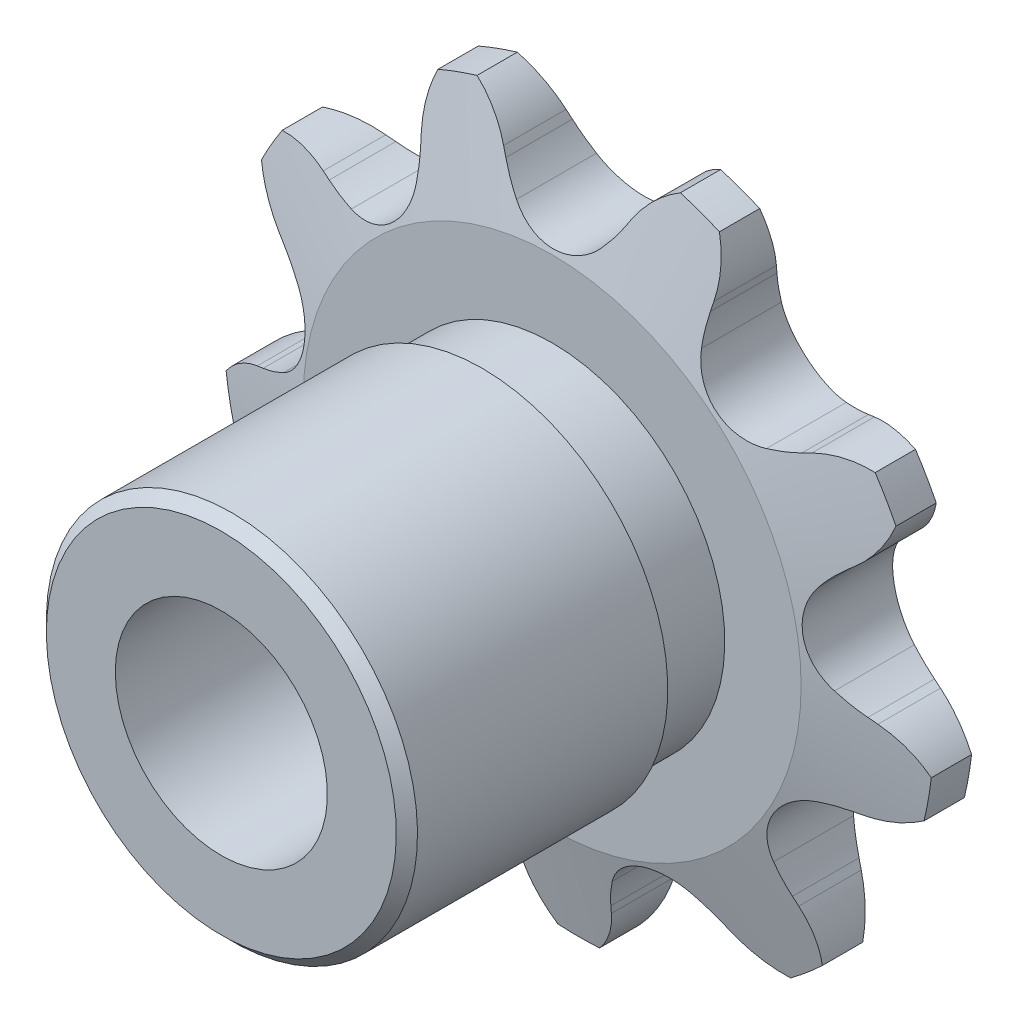
from build123d import *

# Parameters (mm, degrees)
CUT_EXTRUDE1_DEPTH      = 16.095383874
CIRPATTERN1_COUNT       = 9
BOSS_EXTRUDE1_START     = 1.397
SKETCH2_R               = 5.55625
BOSS_EXTRUDE1_DEPTH     = 9.906
CUT_EXTRUDE2_DEPTH      = 19.76608009
CUT_EXTRUDE2_DEPTH_BACK = 19.76608009
SKETCH3_R               = 3.175
SKETCH4_W               = 2.0955
SKETCH4_H               = 5.461


with BuildPart() as part:
    # Sketch1 → Revolve1 (revolve)
    with BuildSketch(Plane(origin=(0, 0, 0), x_dir=(0, 0, -1), z_dir=(1, 0, 0)), mode=Mode.PRIVATE) as revolve1_sk:
        Polygon((1.397, 0), (-1.397, 0), (-1.397, 7.453240807), (-0.60325, 10.628240807), (0.60325, 10.628240807), (1.397, 7.453240807), align=None)
    revolve(revolve1_sk.sketch.rotate(Axis((0, 0, -1.397), (0, 0, 1)), 90), axis=Axis((0, 0, -1.397), (0, 0, 1)))

    # Sketch0 → Cut-Extrude1 (cut, symmetric)
    with BuildSketch(Plane.XY):
        with BuildLine():
            Line((4.911569247, -7.894070248), (4.716762685, -7.729963314))
            ThreePointArc((4.716762685, -7.729963314), (4.36154183, -7.46066159), (3.980565311, -7.229226574))
            ThreePointArc((3.980565311, -7.229226574), (2.5944704, -7.128248838), (1.597567333, -8.096566907))
            ThreePointArc((1.597567333, -8.096566907), (1.454485948, -8.518743401), (1.355474797, -8.953372055))
            Line((1.355474797, -8.953372055), (1.311730217, -9.204304503))
            ThreePointArc((1.311730217, -9.204304503), (0.172611941, -11.008124707), (-1.906433811, -11.486587387))
            ThreePointArc((-1.906433811, -11.486587387), (3.982386258, -10.94151632), (8.843849078, -7.573804406))
            ThreePointArc((8.843849078, -7.573804406), (6.94365775, -8.543665578), (4.911569247, -7.894070248))
        make_face()
    cut_extrude1 = extrude(amount=CUT_EXTRUDE1_DEPTH, both=True, mode=Mode.SUBTRACT)

    # CirPattern1: Cut-Extrude1 ×9 about axis
    cirpattern1_axis = Axis((0, 0, 0), (0, 0, 1))
    for i in range(1, CIRPATTERN1_COUNT):
        add(cut_extrude1.rotate(cirpattern1_axis, i * 360 / CIRPATTERN1_COUNT), mode=Mode.SUBTRACT)

    # Sketch2 → Boss-Extrude1 (add)
    with BuildSketch(Plane.XY.offset(BOSS_EXTRUDE1_START)):
        Circle(SKETCH2_R)
    extrude(amount=BOSS_EXTRUDE1_DEPTH)

    # Sketch3 → Cut-Extrude2 (cut, two sides: drawn at the far end of the back side and taken through both)
    with BuildSketch(Plane.XY.offset(-CUT_EXTRUDE2_DEPTH_BACK)):
        with Locations(Location((0, 0, 0), (0, 0, 180))):
            Circle(SKETCH3_R)
    extrude(amount=CUT_EXTRUDE2_DEPTH + CUT_EXTRUDE2_DEPTH_BACK, mode=Mode.SUBTRACT)

    # Sketch4 → Cut-Revolve1 (revolve, cut)
    with BuildSketch(Plane(origin=(0, 0, 0), x_dir=(0, 0, -1), z_dir=(1, 0, 0))):
        Polygon((-11.303, 5.55625), (-11.303, 5.23875), (-10.9855, 5.55625), align=None)
        with Locations((-2.44475, 7.897740807)):
            Rectangle(SKETCH4_W, SKETCH4_H)
    revolve(axis=Axis((0, 0, -1.397), (0, 0, 1)), mode=Mode.SUBTRACT)


solid = part.part
